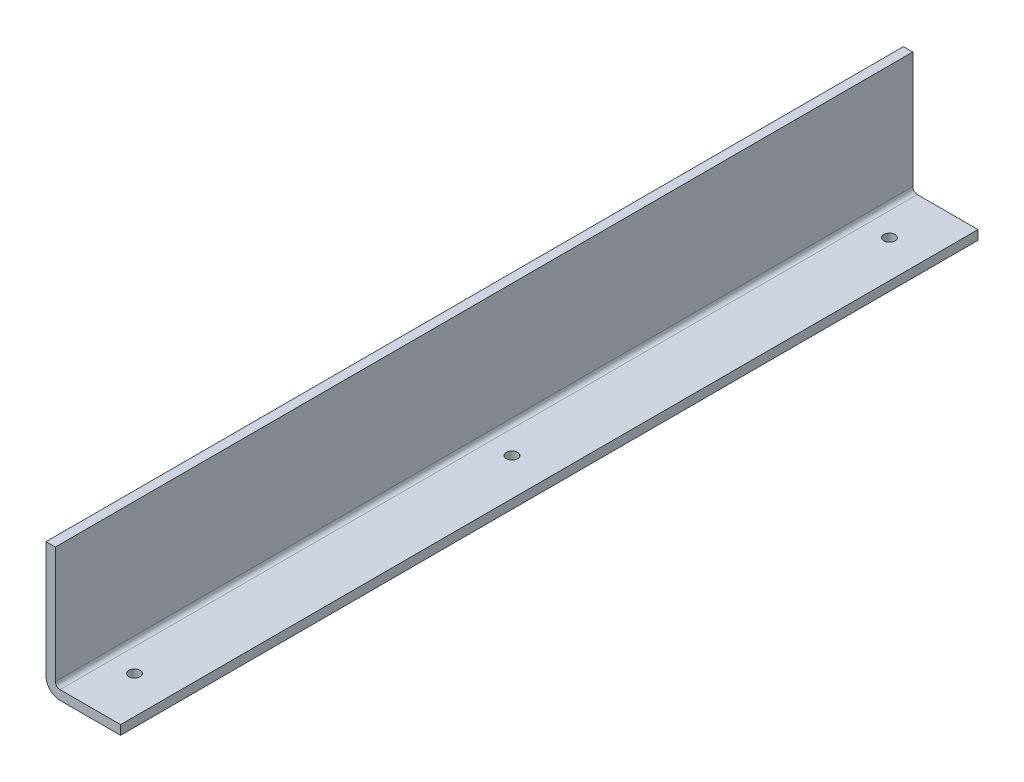
from build123d import *

# Parameters (mm, degrees)
EXTRUDE_1_DEPTH            = 460
SKETCH_2_W                 = 6
SKETCH_2_H                 = 10
PATTERN_LINEAR_1_COUNT     = 2
PATTERN_LINEAR_1_PITCH     = 405
PATTERN_LINEAR_1_COL_COUNT = 2
PATTERN_LINEAR_1_COL_PITCH = 405


with BuildPart() as part:
    # 草图1 → 凸台-拉伸1 (new, symmetric)
    with BuildSketch(Plane.XY):
        with BuildLine():
            Line((0, 140), (0, 15))
            ThreePointArc((0, 15), (4.393398282, 4.393398282), (15, 0))
            Line((15, 0), (80, 0))
            Line((80, 0), (80, 10))
            Line((80, 10), (15, 10))
            ThreePointArc((15, 10), (11.464466094, 11.464466094), (10, 15))
            Line((10, 15), (10, 140))
            Line((10, 140), (0, 140))
        make_face()
    extrude(amount=EXTRUDE_1_DEPTH, both=True)

    # 草图2 → 切除-旋转1 (revolve, cut)
    with BuildSketch(Plane.XY, mode=Mode.PRIVATE) as cut_revolve_1_sk:
        with Locations((43, 5)):
            Rectangle(SKETCH_2_W, SKETCH_2_H)
    cut_revolve_1 = revolve(cut_revolve_1_sk.sketch.rotate(Axis((40, 38.728286981, 0), (0, -1, 0)), 180), axis=Axis((40, 38.728286981, 0), (0, -1, 0)), mode=Mode.SUBTRACT)

    # 阵列(线性)1: 切除-旋转1 ×2
    with Locations(*[(0, 0, i * PATTERN_LINEAR_1_PITCH) for i in range(1, PATTERN_LINEAR_1_COUNT)]):
        add(cut_revolve_1, mode=Mode.SUBTRACT)

    # 阵列(线性)1 col: 切除-旋转1 ×2
    with Locations(*[(0, 0, -i * PATTERN_LINEAR_1_COL_PITCH) for i in range(1, PATTERN_LINEAR_1_COL_COUNT)]):
        add(cut_revolve_1, mode=Mode.SUBTRACT)


solid = part.part
